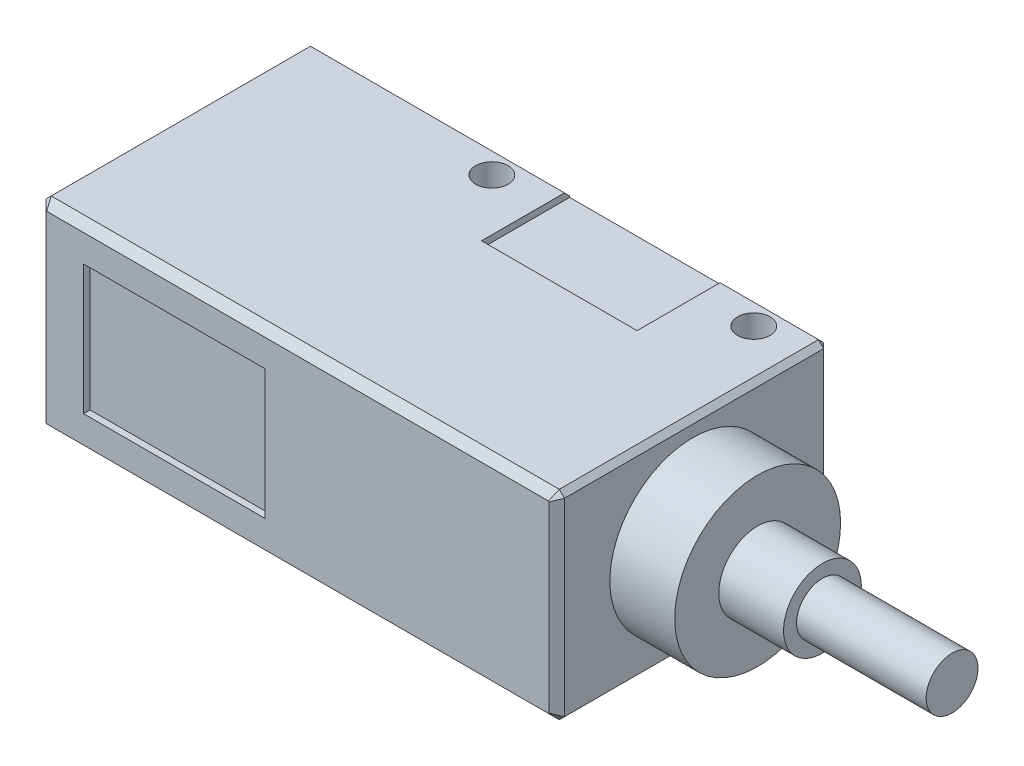
from build123d import *

# Parameters (mm, degrees)
SKETCH1_W           = 21
SKETCH1_H           = 15.4
BOSS_EXTRUDE1_DEPTH = 40
SKETCH2_W           = 14
SKETCH2_H           = 10
CUT_EXTRUDE1_DEPTH  = 0.5
SKETCH3_W           = 12
SKETCH3_H           = 6.8
CUT_EXTRUDE2_DEPTH  = 0.5
CUT_EXTRUDE3_START  = -15.4
SKETCH3_2_W         = 12
SKETCH3_2_H         = 6.8
CUT_EXTRUDE3_DEPTH  = 0.5
M3_TAPPED_HOLE1_D   = 2.5
M3_TAPPED_HOLE2_D   = 2.5
SKETCH8_R           = 6.4
BOSS_EXTRUDE3_DEPTH = 5
SKETCH9_R           = 3
BOSS_EXTRUDE4_DEPTH = 5
SKETCH10_R          = 2
BOSS_EXTRUDE5_DEPTH = 10
CHAMFER1_SIZE       = 0.4
CHAMFER2_SIZE       = 0.6


with BuildPart() as part:
    # Sketch1 → Boss-Extrude1 (new body)
    with BuildSketch(Plane(origin=(0, 0, 0), x_dir=(0, 0, -1), z_dir=(1, 0, 0))):
        Rectangle(SKETCH1_W, SKETCH1_H)
    extrude(amount=BOSS_EXTRUDE1_DEPTH)

    # Sketch2 → Cut-Extrude1 (cut)
    with BuildSketch(Plane.XY.offset(10.5)):
        with Locations((10.5, 0)):
            Rectangle(SKETCH2_W, SKETCH2_H)
    extrude(amount=-CUT_EXTRUDE1_DEPTH, mode=Mode.SUBTRACT)

    # Sketch3 → Cut-Extrude2 (cut)
    with BuildSketch(Plane(origin=(0, 7.7, 0), x_dir=(1, 0, 0), z_dir=(0, 1, 0))):
        with Locations((26, 7.1)):
            Rectangle(SKETCH3_W, SKETCH3_H)
    extrude(amount=-CUT_EXTRUDE2_DEPTH, mode=Mode.SUBTRACT)

    # Sketch3<2> → Cut-Extrude3 (cut)
    with BuildSketch(Plane(origin=(0, 7.7, 0), x_dir=(1, 0, 0), z_dir=(0, 1, 0)).offset(CUT_EXTRUDE3_START)):
        with Locations((26, 7.1)):
            Rectangle(SKETCH3_2_W, SKETCH3_2_H)
    extrude(amount=CUT_EXTRUDE3_DEPTH, mode=Mode.SUBTRACT)

    # M3 Tapped Hole1 (through all)
    with Locations(Plane(origin=(0, 7.7, 0), x_dir=(-1, 0, 0), z_dir=(0, 1, 0))):
        with Locations((-36.2, -8.5)):
            Hole(M3_TAPPED_HOLE1_D / 2)

    # M3 Tapped Hole2 (through all)
    with Locations(Plane(origin=(0, 7.7, 0), x_dir=(-1, 0, 0), z_dir=(0, 1, 0))):
        with Locations((-16, -8.5)):
            Hole(M3_TAPPED_HOLE2_D / 2)

    # Sketch8 → Boss-Extrude3 (add)
    with BuildSketch(Plane(origin=(40, 0, 0), x_dir=(0, 0, -1), z_dir=(1, 0, 0))):
        Circle(SKETCH8_R)
    extrude(amount=BOSS_EXTRUDE3_DEPTH)

    # Sketch9 → Boss-Extrude4 (add)
    with BuildSketch(Plane(origin=(45, 0, 0), x_dir=(0, 0, -1), z_dir=(1, 0, 0))):
        Circle(SKETCH9_R)
    extrude(amount=BOSS_EXTRUDE4_DEPTH)

    # Sketch10 → Boss-Extrude5 (add)
    with BuildSketch(Plane(origin=(50, 0, 0), x_dir=(0, 0, -1), z_dir=(1, 0, 0))):
        Circle(SKETCH10_R)
    extrude(amount=BOSS_EXTRUDE5_DEPTH)

    # Chamfer1
    chamfer1_edges = [part.edges().sort_by_distance(p)[0] for p in [
        (40, -7.7, 0),
        (10, 7.7, -10.5),
        (40, 0, -10.5),
        (10, -7.7, -10.5),
        (0, -7.7, 0),
        (0, 7.7, 0),
        (0, 0, -10.5),
        (40, 7.7, 0),
        (36, -7.7, -10.5),
        (36, 7.7, -10.5),
    ]]
    chamfer(chamfer1_edges, length=CHAMFER1_SIZE)

    # Chamfer2
    chamfer2_edges = [part.edges().sort_by_distance(p)[0] for p in [
        (40, 0, 10.5),
        (0, 0, 10.5),
        (20, -7.7, 10.5),
        (20, 7.7, 10.5),
        (0.2, -7.5, 10.5),
        (0.2, 7.5, 10.5),
        (39.8, -7.5, 10.5),
        (39.8, 7.5, 10.5),
    ]]
    chamfer(chamfer2_edges, length=CHAMFER2_SIZE)


solid = part.part
